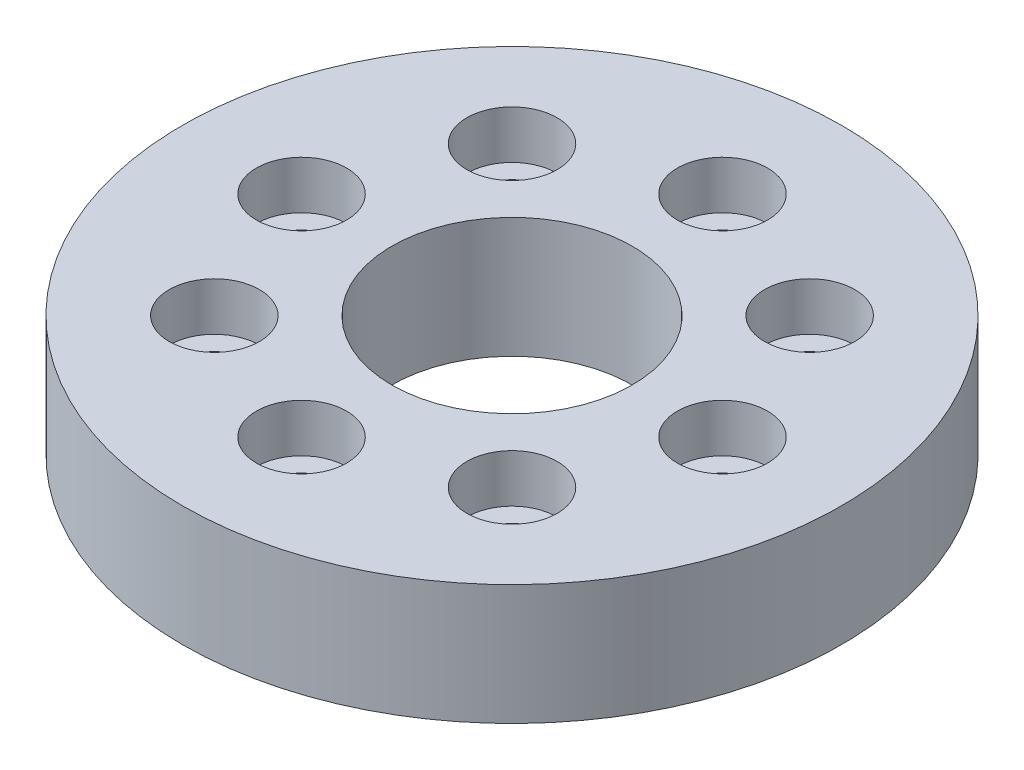
from build123d import *

# Parameters (mm, degrees)
SKETCH1_R           = 27.4
SKETCH1_R_2         = 10
SKETCH1_R_3         = 2
BOSS_EXTRUDE1_DEPTH = 10
SKETCH2_R           = 3.75
CUT_EXTRUDE1_DEPTH  = 4


with BuildPart() as part:
    # Sketch1 → Boss-Extrude1 (new body)
    with BuildSketch(Plane(origin=(0, 0, 0), x_dir=(1, 0, 0), z_dir=(0, 1, 0))):
        with Locations(Location((0, 0, 0), (0, 0, 270))):
            Circle(SKETCH1_R)
        with Locations(Location((0, 0, 0), (0, 0, 270))):
            Circle(SKETCH1_R_2, mode=Mode.SUBTRACT)
        with Locations(Location((0, 17.5, 0), (0, 0, 270))):
            Circle(SKETCH1_R_3, mode=Mode.SUBTRACT)
        with Locations(Location((12.374368671, 12.374368671, 0), (0, 0, 270))):
            Circle(SKETCH1_R_3, mode=Mode.SUBTRACT)
        with Locations(Location((17.5, 0, 0), (0, 0, 270))):
            Circle(SKETCH1_R_3, mode=Mode.SUBTRACT)
        with Locations(Location((12.374368671, -12.374368671, 0), (0, 0, 270))):
            Circle(SKETCH1_R_3, mode=Mode.SUBTRACT)
        with Locations(Location((0, -17.5, 0), (0, 0, 270))):
            Circle(SKETCH1_R_3, mode=Mode.SUBTRACT)
        with Locations(Location((-12.374368671, -12.374368671, 0), (0, 0, 270))):
            Circle(SKETCH1_R_3, mode=Mode.SUBTRACT)
        with Locations(Location((-17.5, 0, 0), (0, 0, 270))):
            Circle(SKETCH1_R_3, mode=Mode.SUBTRACT)
        with Locations(Location((-12.374368671, 12.374368671, 0), (0, 0, 270))):
            Circle(SKETCH1_R_3, mode=Mode.SUBTRACT)
    extrude(amount=BOSS_EXTRUDE1_DEPTH)

    # Sketch2 → Cut-Extrude1 (cut)
    with BuildSketch(Plane(origin=(0, 10, 0), x_dir=(1, 0, 0), z_dir=(0, 1, 0))):
        with Locations(Location((-12.374368671, 12.374368671, 0), (0, 0, 270))):
            Circle(SKETCH2_R)
        with Locations(Location((0, 17.5, 0), (0, 0, 270))):
            Circle(SKETCH2_R)
        with Locations(Location((12.374368671, 12.374368671, 0), (0, 0, 270))):
            Circle(SKETCH2_R)
        with Locations(Location((17.5, 0, 0), (0, 0, 270))):
            Circle(SKETCH2_R)
        with Locations(Location((12.374368671, -12.374368671, 0), (0, 0, 270))):
            Circle(SKETCH2_R)
        with Locations(Location((0, -17.5, 0), (0, 0, 270))):
            Circle(SKETCH2_R)
        with Locations(Location((-12.374368671, -12.374368671, 0), (0, 0, 270))):
            Circle(SKETCH2_R)
        with Locations(Location((-17.5, 0, 0), (0, 0, 270))):
            Circle(SKETCH2_R)
    extrude(amount=-CUT_EXTRUDE1_DEPTH, mode=Mode.SUBTRACT)


solid = part.part
